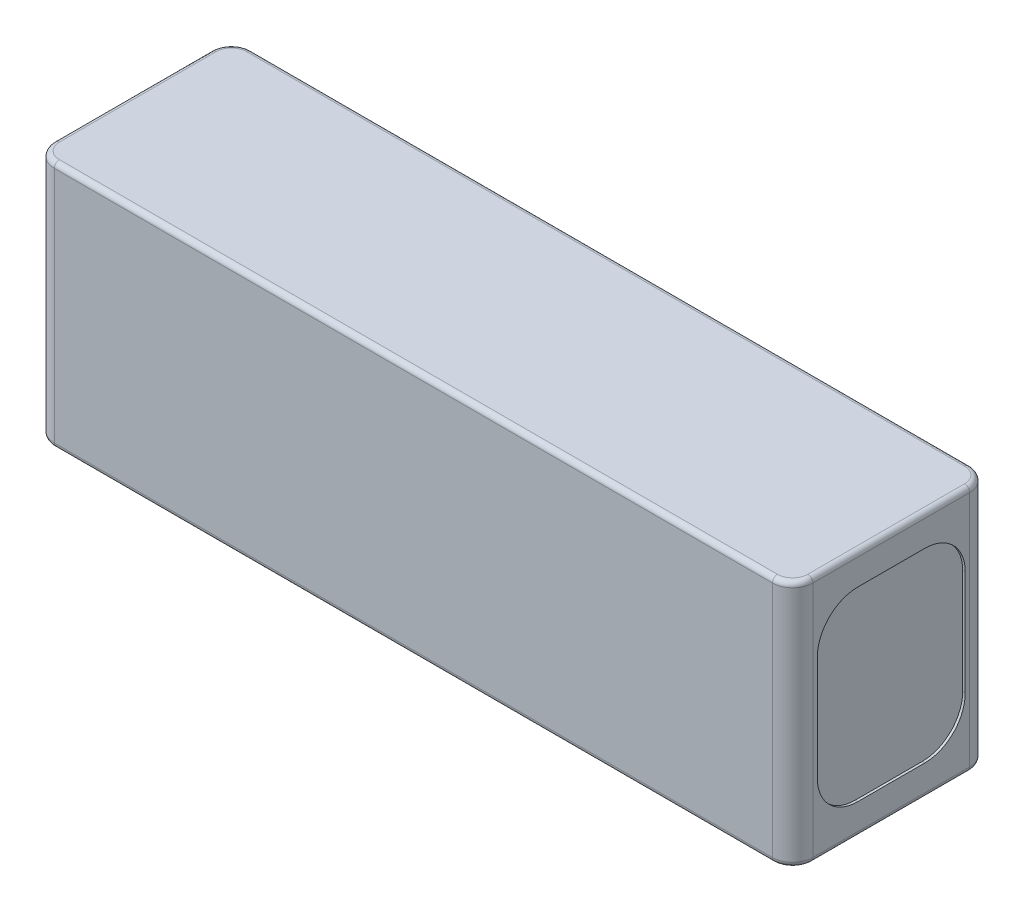
from build123d import *

# Parameters (mm, degrees)
SKETCH1_W           = 150
SKETCH1_H           = 49
BOSS_EXTRUDE1_DEPTH = 39
CUT_EXTRUDE1_DEPTH  = 0.5
CUT_EXTRUDE2_START  = -0.5
CUT_EXTRUDE2_DEPTH  = 0.5
FILLET1_R           = 4
FILLET2_R           = 1


with BuildPart() as part:
    # Sketch1 → Boss-Extrude1 (new body)
    with BuildSketch(Plane(origin=(0, 0, -15), x_dir=(-1, 0, 0), z_dir=(0, 0, -1))):
        with Locations((6, 2.5)):
            Rectangle(SKETCH1_W, SKETCH1_H)
    extrude(amount=-BOSS_EXTRUDE1_DEPTH)

    # Sketch2 → Cut-Extrude1 (cut)
    with BuildSketch(Plane(origin=(69, 0, 0), x_dir=(0, 0, -1), z_dir=(1, 0, 0))):
        with BuildLine():
            Line((-19.125, 12.875), (-19.125, -7.875))
            ThreePointArc((-19.125, -7.875), (-16.781854249, -13.531854249), (-11.125, -15.875))
            Line((-11.125, -15.875), (2.125, -15.875))
            ThreePointArc((2.125, -15.875), (7.781854249, -13.531854249), (10.125, -7.875))
            Line((10.125, -7.875), (10.125, 12.875))
            ThreePointArc((10.125, 12.875), (7.781854249, 18.531854249), (2.125, 20.875))
            Line((2.125, 20.875), (-11.125, 20.875))
            ThreePointArc((-11.125, 20.875), (-16.781854249, 18.531854249), (-19.125, 12.875))
        make_face()
    extrude(amount=-CUT_EXTRUDE1_DEPTH, mode=Mode.SUBTRACT)

    # Sketch3 → Cut-Extrude2 (cut)
    with BuildSketch(Plane.ZY.offset(81).offset(CUT_EXTRUDE2_START)):
        with BuildLine():
            Line((11.125, 20.875), (-2.125, 20.875))
            ThreePointArc((-2.125, 20.875), (-7.781854249, 18.531854249), (-10.125, 12.875))
            Line((-10.125, 12.875), (-10.125, -7.875))
            ThreePointArc((-10.125, -7.875), (-7.781854249, -13.531854249), (-2.125, -15.875))
            Line((-2.125, -15.875), (11.125, -15.875))
            ThreePointArc((11.125, -15.875), (16.781854249, -13.531854249), (19.125, -7.875))
            Line((19.125, -7.875), (19.125, 12.875))
            ThreePointArc((19.125, 12.875), (16.781854249, 18.531854249), (11.125, 20.875))
        make_face()
    extrude(amount=CUT_EXTRUDE2_DEPTH, mode=Mode.SUBTRACT)

    # Fillet1
    fillet1_edges = [part.edges().sort_by_distance(p)[0] for p in [
        (-81, 2.5, 24),
        (69, 2.5, 24),
        (-81, 2.5, -15),
        (69, 2.5, -15),
    ]]
    fillet(fillet1_edges, radius=FILLET1_R)

    # Fillet2
    fillet2_edges = [part.edges().sort_by_distance(p)[0] for p in [
        (-6, -22, -15),
        (-6, 27, -15),
        (-81, 27, 4.5),
        (-6, 27, 24),
        (69, 27, 4.5),
        (67.828427125, 27, 22.828427125),
        (67.828427125, 27, -13.828427125),
        (-79.828427125, 27, 22.828427125),
        (-79.828427125, 27, -13.828427125),
        (-81, -22, 4.5),
        (69, -22, 4.5),
        (-6, -22, 24),
        (67.828427125, -22, 22.828427125),
        (67.828427125, -22, -13.828427125),
        (-79.828427125, -22, 22.828427125),
        (-79.828427125, -22, -13.828427125),
    ]]
    fillet(fillet2_edges, radius=FILLET2_R)


solid = part.part
